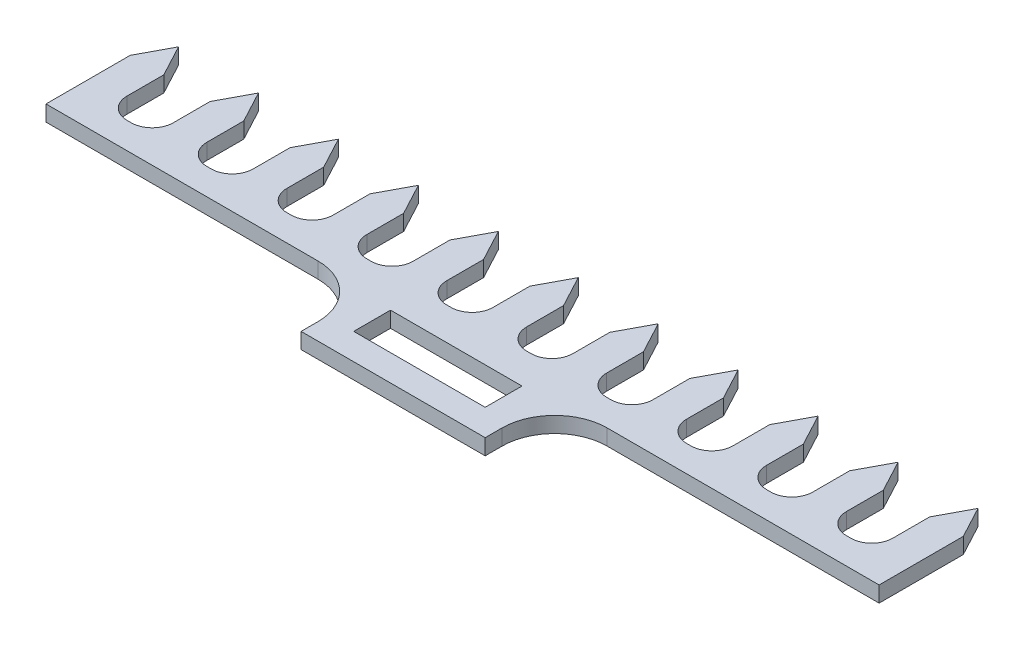
from build123d import *

# Parameters (mm, degrees)
BOSS_EXTRUDE1_DEPTH = 3
BOSS_EXTRUDE2_DEPTH = 3
FILLET1_R           = 4
LPATTERN1_COUNT     = 5
LPATTERN1_PITCH     = 30.4
SKETCH5_W           = 158.4
SKETCH5_H           = 3
BOSS_EXTRUDE3_DEPTH = 15
SKETCH6_W           = 25
SKETCH6_H           = 7
CUT_EXTRUDE1_DEPTH  = 60
SKETCH7_W           = 61.7
SKETCH7_H           = 13.2
CUT_EXTRUDE2_DEPTH  = 10
FILLET2_R           = 10


with BuildPart() as part:
    # Sketch1 → Boss-Extrude1 (new body)
    with BuildSketch(Plane(origin=(0, 0, 0), x_dir=(1, 0, 0), z_dir=(0, 1, 0))):
        Polygon((26, -9.073446812), (-10.8, -9.073446812), (-10.8, -5.873446812), (-10.8, 5.126553188), (-4.4, 5.126553188), (-4.4, -5.873446812), (4.4, -5.873446812), (4.4, 5.126553188), (10.798731059, 5.126553188), (10.798731059, -5.873446812), (19.6, -5.873446812), (19.6, 5.126553188), (26, 5.126553188), align=None)
    extrude(amount=BOSS_EXTRUDE1_DEPTH)

    # Sketch2 → Boss-Extrude2 (add)
    with BuildSketch(Plane(origin=(0, 3, 0), x_dir=(1, 0, 0), z_dir=(0, 1, 0))):
        Polygon((-10.8, 5.126553188), (-7.6, 11.126553188), (-4.4, 5.126553188), align=None)
        Polygon((4.4, 5.126553188), (7.59936553, 11.126553188), (10.798731059, 5.126553188), align=None)
        Polygon((19.6, 5.126553188), (22.8, 11.126553188), (26, 5.126553188), align=None)
    extrude(amount=-BOSS_EXTRUDE2_DEPTH)

    # Fillet1
    fillet1_edges = [part.edges().sort_by_distance(p)[0] for p in [
        (-4.4, 1.5, 5.873446812),
        (4.4, 1.5, 5.873446812),
        (10.798731059, 1.5, 5.873446812),
        (19.6, 1.5, 5.873446812),
    ]]
    fillet(fillet1_edges, radius=FILLET1_R)


with BuildPart() as lpattern1_1:
    # LPattern1: pattern copy
    add(part.part.moved(Location(Vector(1, 0, 0) * (1 * LPATTERN1_PITCH))))


with BuildPart() as lpattern1_2:
    # LPattern1: pattern copy
    add(part.part.moved(Location(Vector(1, 0, 0) * (2 * LPATTERN1_PITCH))))


with BuildPart() as lpattern1_3:
    # LPattern1: pattern copy
    add(part.part.moved(Location(Vector(1, 0, 0) * (3 * LPATTERN1_PITCH))))


with BuildPart() as lpattern1_4:
    # LPattern1: pattern copy
    add(part.part.moved(Location(Vector(1, 0, 0) * (4 * LPATTERN1_PITCH))))


with BuildPart() as part_1:
    add(part.part)

    # Combine1: union LPattern1_1, LPattern1_2, LPattern1_3, LPattern1_4
    add(lpattern1_1.part)
    add(lpattern1_2.part)
    add(lpattern1_3.part)
    add(lpattern1_4.part)

    # Sketch5 → Boss-Extrude3 (add)
    with BuildSketch(Plane.XY.offset(9.073446812)):
        with Locations((68.4, 1.5)):
            Rectangle(SKETCH5_W, SKETCH5_H)
    extrude(amount=BOSS_EXTRUDE3_DEPTH)

    # Sketch6 → Cut-Extrude1 (cut)
    with BuildSketch(Plane(origin=(0, 3, 0), x_dir=(1, 0, 0), z_dir=(0, 1, 0))):
        with Locations((68.4, -15.573446812)):
            Rectangle(SKETCH6_W, SKETCH6_H)
    extrude(amount=-CUT_EXTRUDE1_DEPTH, mode=Mode.SUBTRACT)

    # Sketch7 → Cut-Extrude2 (cut)
    with BuildSketch(Plane(origin=(0, 3, 0), x_dir=(1, 0, 0), z_dir=(0, 1, 0))):
        with Locations((20.05, -17.473446812)):
            Rectangle(SKETCH7_W, SKETCH7_H)
        with Locations((116.75, -17.473446812)):
            Rectangle(SKETCH7_W, SKETCH7_H)
    extrude(amount=-CUT_EXTRUDE2_DEPTH, mode=Mode.SUBTRACT)

    # Fillet2
    fillet2_edges = [part_1.edges().sort_by_distance(p)[0] for p in [
        (50.9, 1.5, 10.873446812),
        (85.9, 1.5, 10.873446812),
    ]]
    fillet(fillet2_edges, radius=FILLET2_R)


solid = part_1.part
